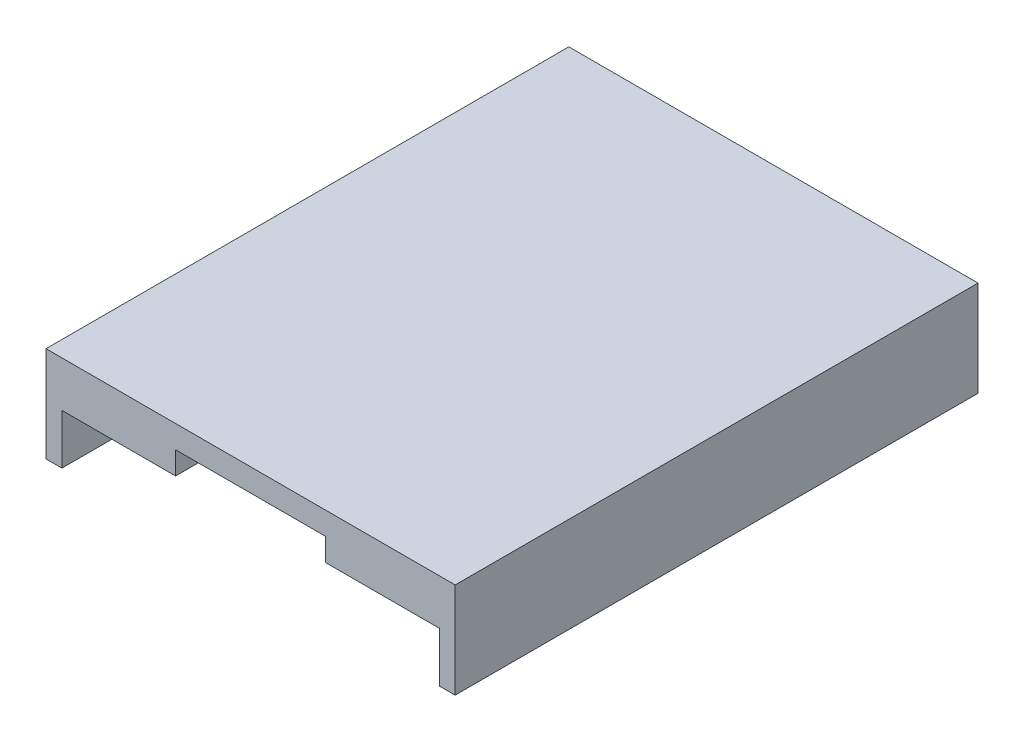
from build123d import *

# Parameters (mm, degrees)
BOSS_EXTRUDE1_DEPTH = 57.5


with BuildPart() as part:
    # Sketch1 → Boss-Extrude1 (new, symmetric)
    with BuildSketch(Plane.XY):
        Polygon((0, 0), (0, 21), (90, 21), (90, 0), (86.5, 0), (86.5, 11), (61.5, 11), (61.5, 16), (28.5, 16), (28.5, 11), (3.5, 11), (3.5, 0), align=None)
    extrude(amount=BOSS_EXTRUDE1_DEPTH, both=True)


solid = part.part
